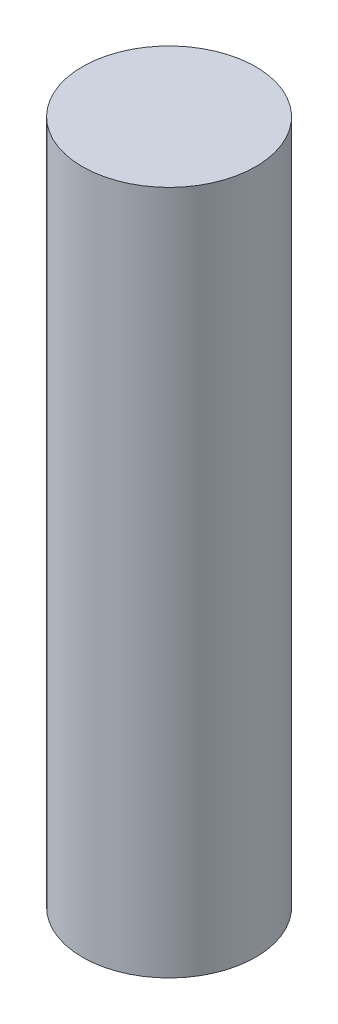
from build123d import *

# Parameters (mm, degrees)
SKETCH1_R           = 9
BOSS_EXTRUDE1_DEPTH = 71.12


with BuildPart() as part:
    # Sketch1 → Boss-Extrude1 (new body)
    with BuildSketch(Plane(origin=(0, 0, 0), x_dir=(1, 0, 0), z_dir=(0, 1, 0))):
        with Locations(Location((0, 0, 0), (0, 0, 270))):
            Circle(SKETCH1_R)
    extrude(amount=BOSS_EXTRUDE1_DEPTH)


solid = part.part
